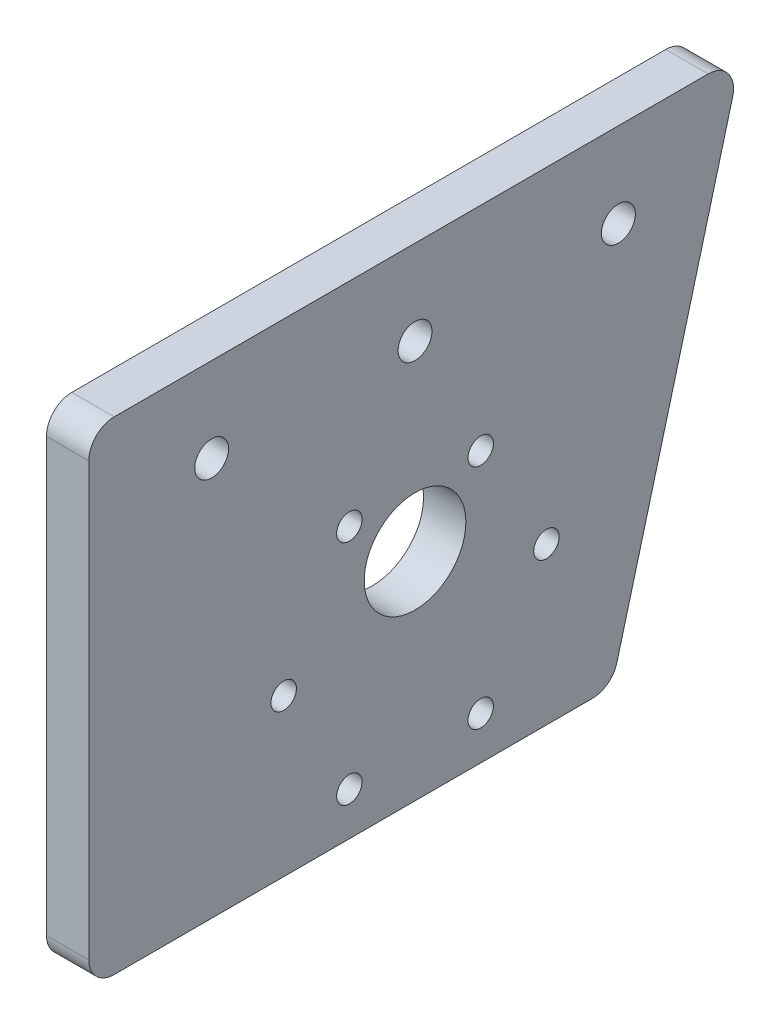
from build123d import *

# Parameters (mm, degrees)
SKETCH1_R           = 6
SKETCH1_R_2         = 2
SKETCH1_R_3         = 1.5
BOSS_EXTRUDE1_DEPTH = 5
FILLET1_R           = 3


with BuildPart() as part:
    # Sketch1 → Boss-Extrude1 (new body)
    with BuildSketch(Plane(origin=(0, 0, 0), x_dir=(0, 0, -1), z_dir=(1, 0, 0))):
        Polygon((0, 0), (77, 0), (61.726896031, -57), (0, -57), align=None)
        with Locations((38.5, -31.5)):
            Circle(SKETCH1_R, mode=Mode.SUBTRACT)
        with Locations((38.5, -10)):
            Circle(SKETCH1_R_2, mode=Mode.SUBTRACT)
        with Locations((62.5, -10)):
            Circle(SKETCH1_R_2, mode=Mode.SUBTRACT)
        with Locations((14.5, -10)):
            Circle(SKETCH1_R_2, mode=Mode.SUBTRACT)
        with Locations((23, -38.5)):
            Circle(SKETCH1_R_3, mode=Mode.SUBTRACT)
        with Locations((30.75, -25.076606241)):
            Circle(SKETCH1_R_3, mode=Mode.SUBTRACT)
        with Locations((46.25, -25.076606241)):
            Circle(SKETCH1_R_3, mode=Mode.SUBTRACT)
        with Locations((54, -38.5)):
            Circle(SKETCH1_R_3, mode=Mode.SUBTRACT)
        with Locations((46.25, -51.923393759)):
            Circle(SKETCH1_R_3, mode=Mode.SUBTRACT)
        with Locations((30.75, -51.923393759)):
            Circle(SKETCH1_R_3, mode=Mode.SUBTRACT)
    extrude(amount=BOSS_EXTRUDE1_DEPTH)

    # Fillet1
    fillet1_edges = [part.edges().sort_by_distance(p)[0] for p in [
        (2.5, 0, 0),
        (2.5, 0, -77),
        (2.5, -57, -61.726896031),
        (2.5, -57, 0),
    ]]
    fillet(fillet1_edges, radius=FILLET1_R)


solid = part.part
